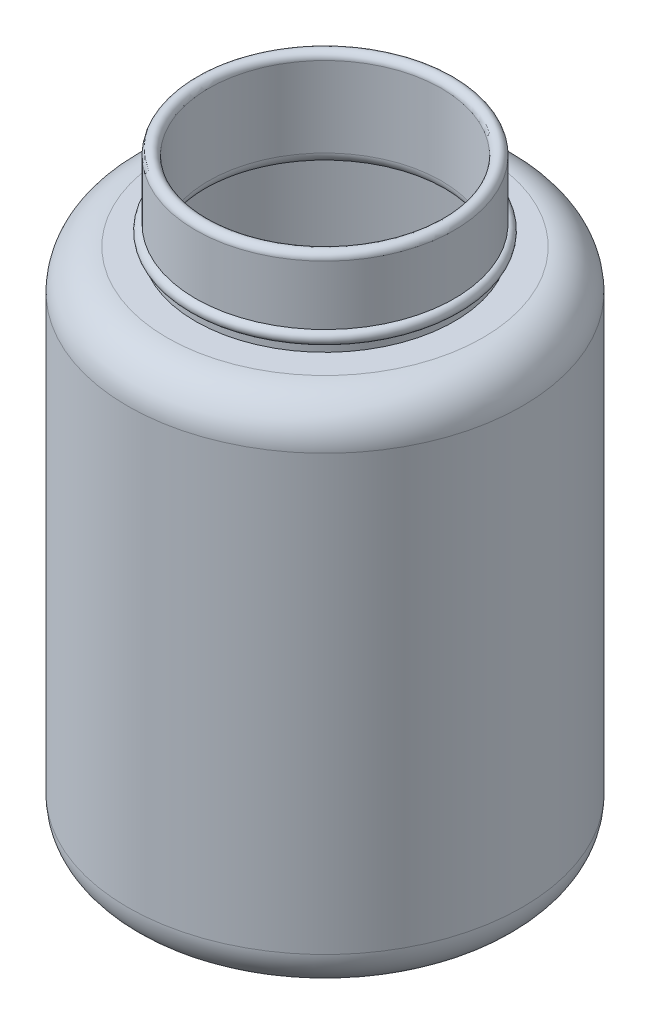
from build123d import *


with BuildPart() as part:
    # Croquis1 → Revolución1 (revolve)
    with BuildSketch(Plane.XY, mode=Mode.PRIVATE) as revoluci_n1_sk:
        with BuildLine():
            Line((0, 0), (40, 0))
            ThreePointArc((40, 0), (47.071067812, 2.928932188), (50, 10))
            Line((50, 10), (50, 120))
            ThreePointArc((50, 120), (47.071067812, 127.071067812), (40, 130))
            Line((40, 130), (32.8, 130))
            Line((32.8, 130), (32.8, 132))
            ThreePointArc((32.8, 132), (34.3, 133.5), (32.8, 135))
            Line((32.8, 135), (32.8, 150))
            ThreePointArc((32.8, 150), (31.15, 151.65), (29.5, 150))
            Line((29.5, 150), (29.5, 129.7))
            ThreePointArc((29.5, 129.7), (30.378679656, 127.578679656), (32.5, 126.7))
            Line((32.5, 126.7), (40, 126.7))
            ThreePointArc((40, 126.7), (44.737615434, 124.737615434), (46.7, 120))
            Line((46.7, 120), (46.7, 10))
            ThreePointArc((46.7, 10), (44.737615434, 5.262384566), (40, 3.3))
            Line((40, 3.3), (0, 3.3))
            Line((0, 3.3), (0, 0))
        make_face()
    revolve(revoluci_n1_sk.sketch.rotate(Axis((0, 0, 0), (0, 1, 0)), 90), axis=Axis((0, 0, 0), (0, 1, 0)))


solid = part.part
